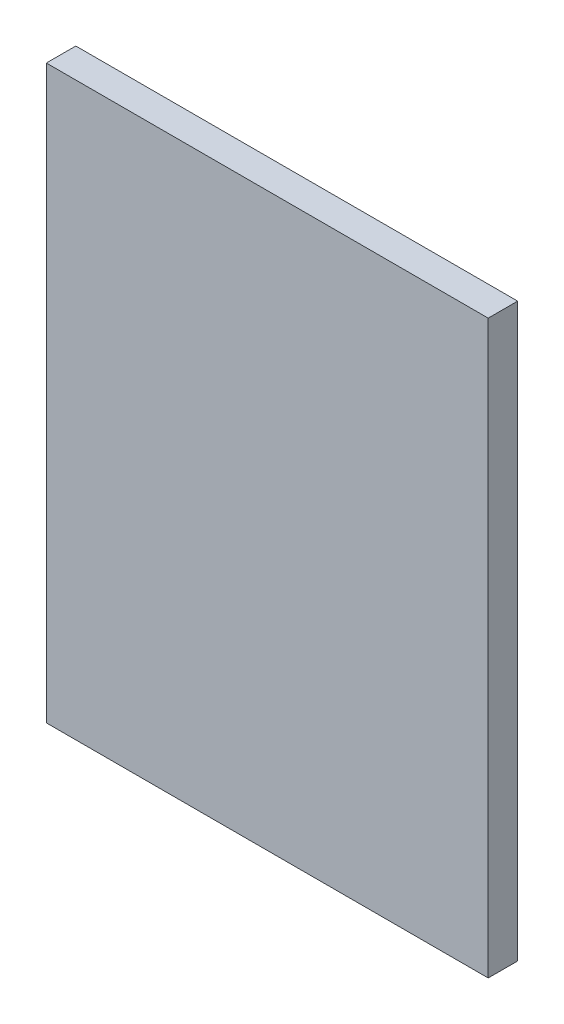
from build123d import *

# Parameters (mm, degrees)
SKETCH1_W           = 75
SKETCH1_H           = 97
BOSS_EXTRUDE1_DEPTH = 5


with BuildPart() as part:
    # Sketch1 → Boss-Extrude1 (new body)
    with BuildSketch(Plane.XY):
        with Locations((-38.136160714, -0.486607143)):
            Rectangle(SKETCH1_W, SKETCH1_H)
    extrude(amount=BOSS_EXTRUDE1_DEPTH)


solid = part.part
